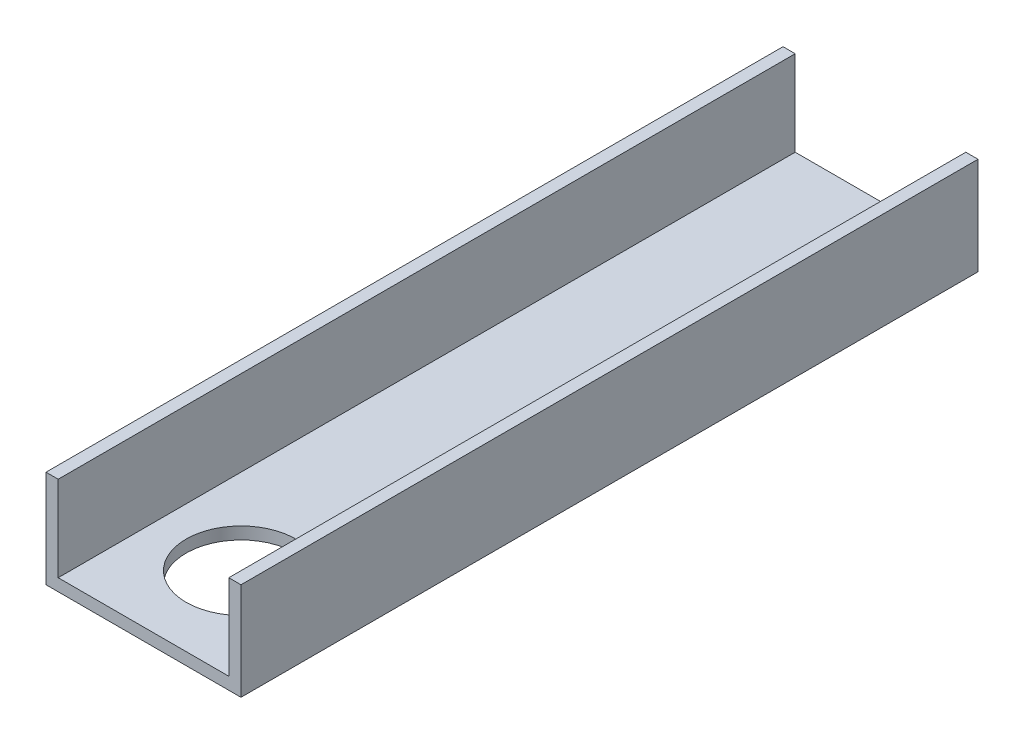
from build123d import *

# Parameters (mm, degrees)
EXTRUDE_F_DEPTH    = 192.024
CUT_EXTRUDE1_REACH = 201.869
SKETCH2_R          = 14.2875


with BuildPart() as part:
    # Sketch1 → Extrude f (new body)
    with BuildSketch(Plane.XY):
        Polygon((3.175, 3.175), (3.175, 25.4), (0, 25.4), (0, 0), (50.8, 0), (50.8, 25.4), (47.625, 25.4), (47.625, 3.175), align=None)
    extrude(amount=EXTRUDE_F_DEPTH)

    # Sketch2 → Cut-Extrude1 (cut, up to next)
    with BuildSketch(Plane(origin=(0, 3.175, 0), x_dir=(1, 0, 0), z_dir=(0, 1, 0)), mode=Mode.PRIVATE) as cut_extrude1_sk1:
        with Locations(Location((25.4, -166.624, 0), (0, 0, 270))):
            Circle(SKETCH2_R)
    cut_extrude1_tool1 = extrude(cut_extrude1_sk1.sketch, amount=-CUT_EXTRUDE1_REACH, mode=Mode.PRIVATE) & part.part
    add(cut_extrude1_tool1.solids().sort_by_distance((25.4, 3.175, 166.624))[0], mode=Mode.SUBTRACT)


solid = part.part
